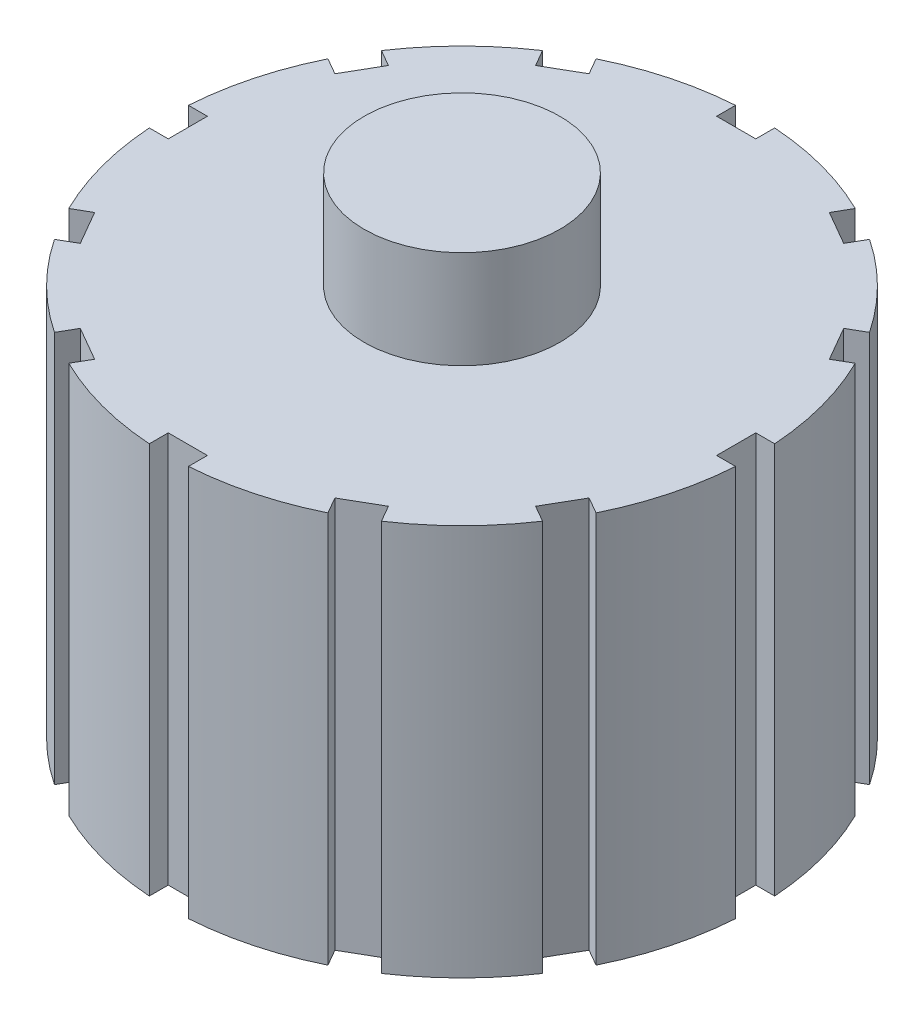
from build123d import *

# Parameters (mm, degrees)
SKETCH_1_R               = 15
EXTRUDE_1_DEPTH          = 20
SKETCH_2_R               = 5
EXTRUDE_2_DEPTH          = 5
SKETCH_3_W               = 2
SKETCH_3_H               = 2
CUT_EXTRUDE_1_DEPTH      = 33.787192622
PATTERN_CIRCULAR_1_COUNT = 12
SKETCH_4_R               = 3
CUT_EXTRUDE_2_DEPTH      = 12


with BuildPart() as part:
    # 草图1 → 凸台-拉伸1 (new body)
    with BuildSketch(Plane(origin=(0, 0, 0), x_dir=(1, 0, 0), z_dir=(0, 1, 0))):
        Circle(SKETCH_1_R)
    extrude(amount=EXTRUDE_1_DEPTH)

    # 草图2 → 凸台-拉伸2 (add)
    with BuildSketch(Plane(origin=(0, 20, 0), x_dir=(1, 0, 0), z_dir=(0, 1, 0))):
        Circle(SKETCH_2_R)
    extrude(amount=EXTRUDE_2_DEPTH)

    # 草图3 → 切除-拉伸1 (cut, through all)
    with BuildSketch(Plane(origin=(0, 0, 0), x_dir=(1, 0, 0), z_dir=(0, 1, 0))):
        with Locations((15, 0)):
            Rectangle(SKETCH_3_W, SKETCH_3_H)
    cut_extrude_1 = extrude(amount=CUT_EXTRUDE_1_DEPTH, mode=Mode.SUBTRACT)

    # 阵列(圆周)1: 切除-拉伸1 ×12 about axis
    pattern_circular_1_axis = Axis((0, -1.25, 0), (0, 1, 0))
    for i in range(1, PATTERN_CIRCULAR_1_COUNT):
        add(cut_extrude_1.rotate(pattern_circular_1_axis, i * 360 / PATTERN_CIRCULAR_1_COUNT), mode=Mode.SUBTRACT)

    # 草图4 → 切除-拉伸2 (cut)
    with BuildSketch(Plane(origin=(0, 0, 0), x_dir=(1, 0, 0), z_dir=(0, 1, 0))):
        Circle(SKETCH_4_R)
    extrude(amount=CUT_EXTRUDE_2_DEPTH, mode=Mode.SUBTRACT)


solid = part.part
